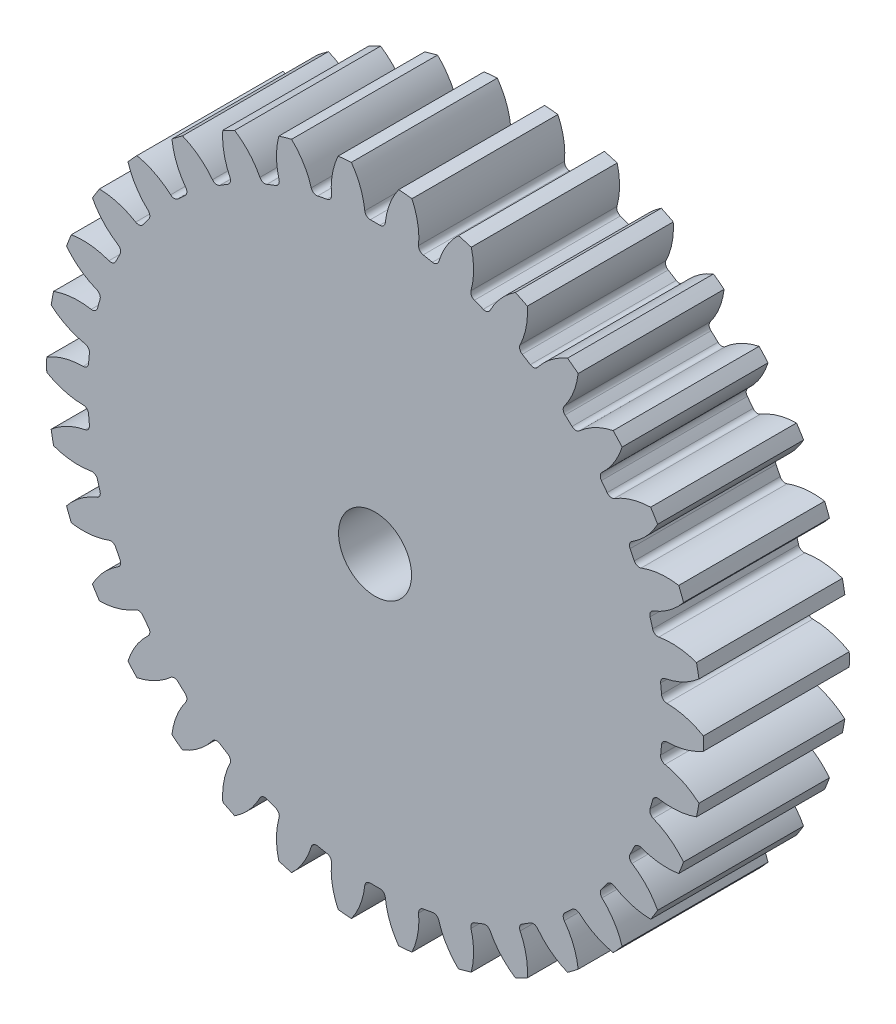
from build123d import *

# Parameters (mm, degrees)
IZIM1_R                        = 36
Y_KSEKLIK_EKSTR_ZYON1_DEPTH    = 8
KES_EKSTR_ZYON1_DEPTH          = 16
RADYUS1_R                      = 0.6
DAIRESEL_KAPLAMA1_COUNT        = 34
RADYUS1_OF_DAIRESEL_KAPLAMA1_R = 0.6
SKETCH5_R                      = 4
CUT_EXTRUDE1_DEPTH             = 54
SKETCH6_R                      = 7.5
SKETCH6_R_2                    = 4
BOSS_EXTRUDE1_DEPTH            = 10
CUT_EXTRUDE3_DEPTH             = 54.937601058
CUT_EXTRUDE3_DEPTH_BACK        = 54.937601058
SKETCH7_R                      = 2.1
FILLET1_R                      = 1


with BuildPart() as part:
    # Çizim1 → Yükseklik-Ekstrüzyon1 (new, symmetric)
    with BuildSketch(Plane.XY):
        Circle(IZIM1_R)
    extrude(amount=Y_KSEKLIK_EKSTR_ZYON1_DEPTH, both=True)

    # Çizim2 → Kes-Ekstrüzyon1 (cut)
    with BuildSketch(Plane.XY.offset(8)):
        with BuildLine():
            ThreePointArc((-3.382543143, 36.845059396), (-1.733935189, 34.377607641), (-1.088142285, 31.481199888))
            ThreePointArc((-1.088142285, 31.481199888), (0, 31.5), (1.088142285, 31.481199888))
            ThreePointArc((1.088142285, 31.481199888), (1.733935189, 34.377607641), (3.382543143, 36.845059396))
            ThreePointArc((3.382543143, 36.845059396), (0, 37), (-3.382543143, 36.845059396))
        make_face()
    kes_ekstr_zyon1 = extrude(amount=-KES_EKSTR_ZYON1_DEPTH, mode=Mode.SUBTRACT)

    # Radyus1
    radyus1_edges = [part.edges().sort_by_distance(p)[0] for p in [
        (-1.088142285, 31.481199888, 0),
        (1.088142285, 31.481199888, 0),
    ]]
    fillet(radyus1_edges, radius=RADYUS1_R)

    # Dairesel Kaplama1: Kes-Ekstrüzyon1 ×34 about axis
    dairesel_kaplama1_axis = Axis((0, 0, 0), (0, 0, 1))
    for i in range(1, DAIRESEL_KAPLAMA1_COUNT):
        add(kes_ekstr_zyon1.rotate(dairesel_kaplama1_axis, i * 360 / DAIRESEL_KAPLAMA1_COUNT), mode=Mode.SUBTRACT)

    # Radyus1 of Dairesel Kaplama1
    radyus1_of_dairesel_kaplama1_edges = [part.edges().sort_by_distance(p)[0] for p in [
        (-6.854269894, 30.745227015, 0),
        (-4.715040705, 31.145118256, 0),
        (-12.386983563, 28.962262312, 0),
        (-10.357658639, 29.748426976, 0),
        (-17.497873364, 26.193022501, 0),
        (-15.64755893, 27.338688694, 0),
        (-22.012894073, 22.531810725, 0),
        (-20.404600369, 23.997964159, 0),
        (-25.778292076, 18.103305158, 0),
        (-24.466787616, 19.840017736, 0),
        (-28.66584126, 13.058313247, 0),
        (-27.695787754, 15.006443305, 0),
        (-30.577209601, 7.568636139, 0),
        (-29.981641059, 9.661842445, 0),
        (-31.447307742, 1.821218206, 0),
        (-31.246505535, 3.988219129, 0),
        (-31.246505535, -3.988219129, 0),
        (-31.447307742, -1.821218206, 0),
        (-29.981641059, -9.661842445, 0),
        (-30.577209601, -7.568636139, 0),
        (-27.695787754, -15.006443305, 0),
        (-28.66584126, -13.058313247, 0),
        (-24.466787616, -19.840017736, 0),
        (-25.778292076, -18.103305158, 0),
        (-20.404600369, -23.997964159, 0),
        (-22.012894073, -22.531810725, 0),
        (-15.64755893, -27.338688694, 0),
        (-17.497873364, -26.193022501, 0),
        (-10.357658639, -29.748426976, 0),
        (-12.386983563, -28.962262312, 0),
        (-4.715040705, -31.145118256, 0),
        (-6.854269894, -30.745227015, 0),
        (1.088142285, -31.481199888, 0),
        (-1.088142285, -31.481199888, 0),
        (6.854269894, -30.745227015, 0),
        (4.715040705, -31.145118256, 0),
        (12.386983563, -28.962262312, 0),
        (10.357658639, -29.748426976, 0),
        (17.497873364, -26.193022501, 0),
        (15.64755893, -27.338688694, 0),
        (22.012894073, -22.531810725, 0),
        (20.404600369, -23.997964159, 0),
        (25.778292076, -18.103305158, 0),
        (24.466787616, -19.840017736, 0),
        (28.66584126, -13.058313247, 0),
        (27.695787754, -15.006443305, 0),
        (30.577209601, -7.568636139, 0),
        (29.981641059, -9.661842445, 0),
        (31.447307742, -1.821218206, 0),
        (31.246505535, -3.988219129, 0),
        (31.246505535, 3.988219129, 0),
        (31.447307742, 1.821218206, 0),
        (29.981641059, 9.661842445, 0),
        (30.577209601, 7.568636139, 0),
        (27.695787754, 15.006443305, 0),
        (28.66584126, 13.058313247, 0),
        (24.466787616, 19.840017736, 0),
        (25.778292076, 18.103305158, 0),
        (20.404600369, 23.997964159, 0),
        (22.012894073, 22.531810725, 0),
        (15.64755893, 27.338688694, 0),
        (17.497873364, 26.193022501, 0),
        (10.357658639, 29.748426976, 0),
        (12.386983563, 28.962262312, 0),
        (4.715040705, 31.145118256, 0),
        (6.854269894, 30.745227015, 0),
    ]]
    fillet(radyus1_of_dairesel_kaplama1_edges, radius=RADYUS1_OF_DAIRESEL_KAPLAMA1_R)

    # Sketch5 → Cut-Extrude1 (cut)
    with BuildSketch(Plane.XY.offset(8)):
        Circle(SKETCH5_R)
    extrude(amount=-CUT_EXTRUDE1_DEPTH, mode=Mode.SUBTRACT)

    # Sketch6 → Boss-Extrude1 (add)
    with BuildSketch(Plane(origin=(0, 0, -8), x_dir=(-1, 0, 0), z_dir=(0, 0, -1))):
        with Locations(Location((0, 0, 0), (0, 0, 180))):
            Circle(SKETCH6_R)
        with Locations(Location((0, 0, 0), (0, 0, 180))):
            Circle(SKETCH6_R_2, mode=Mode.SUBTRACT)
    extrude(amount=BOSS_EXTRUDE1_DEPTH)

    # Sketch7 → Cut-Extrude3 (cut, two sides: drawn at the far end of the back side and taken through both)
    with BuildSketch(Plane(origin=(0, 0, 0), x_dir=(1, 0, 0), z_dir=(0, 1, 0)).offset(-CUT_EXTRUDE3_DEPTH_BACK)):
        with Locations(Location((0, 13, 0), (0, 0, 270))):
            Circle(SKETCH7_R)
    extrude(amount=CUT_EXTRUDE3_DEPTH + CUT_EXTRUDE3_DEPTH_BACK, mode=Mode.SUBTRACT)

    # Fillet1
    fillet1_edges = [part.edges().sort_by_distance(p)[0] for p in [
        (-7.5, 0, -18),
    ]]
    fillet(fillet1_edges, radius=FILLET1_R)


solid = part.part
